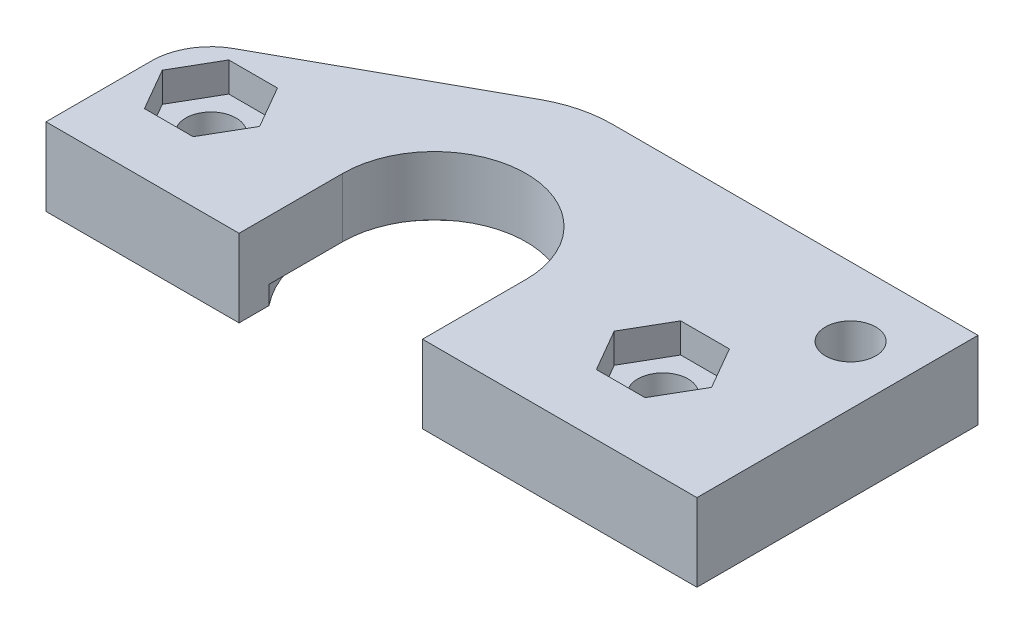
from build123d import *

# Parameters (mm, degrees)
ESBO_O1_R                = 1.7
RESSALTO_EXTRUS_O1_DEPTH = 5.25
ESBO_O2_R                = 7.95
CORTE_EXTRUS_O1_DEPTH    = 1.25
FILETE1_R                = 4
FILETE2_R                = 8
CORTE_EXTRUS_O2_DEPTH    = 2


with BuildPart() as part:
    # Esboço1 → Ressalto-extrusão1 (new body)
    with BuildSketch(Plane(origin=(0, 0, 0), x_dir=(1, 0, 0), z_dir=(0, 1, 0))):
        with BuildLine():
            Line((13.05, 0), (13.05, 7))
            ThreePointArc((13.05, 7), (19.25, 13.2), (25.45, 7))
            Line((25.45, 7), (25.45, 0))
            Line((25.45, 0), (44, 0))
            Line((44, 0), (44, 19))
            Line((44, 19), (17.2, 19))
            Line((17.2, 19), (0, 9.5))
            Line((0, 9.5), (0, 0))
            Line((0, 0), (13.05, 0))
        make_face()
        with Locations(Location((4.2, 6.95, 0), (0, 0, 90))):
            Circle(ESBO_O1_R, mode=Mode.SUBTRACT)
        with Locations(Location((34.75, 6.95, 0), (0, 0, 90))):
            Circle(ESBO_O1_R, mode=Mode.SUBTRACT)
        with Locations(Location((40.05, 14.337730871, 0), (0, 0, 90))):
            Circle(ESBO_O1_R, mode=Mode.SUBTRACT)
    extrude(amount=RESSALTO_EXTRUS_O1_DEPTH)

    # Esboço2 → Corte-extrusão1 (cut)
    with BuildSketch(Plane(origin=(0, 0, 0), x_dir=(1, 0, 0), z_dir=(0, 1, 0))):
        with Locations((19.25, 7)):
            Circle(ESBO_O2_R)
    extrude(amount=CORTE_EXTRUS_O1_DEPTH, mode=Mode.SUBTRACT)

    # Filete1
    filete1_edges = [part.edges().sort_by_distance(p)[0] for p in [
        (0, 2.625, -9.5),
    ]]
    fillet(filete1_edges, radius=FILETE1_R)

    # Filete2
    filete2_edges = [part.edges().sort_by_distance(p)[0] for p in [
        (17.2, 2.625, -19),
    ]]
    fillet(filete2_edges, radius=FILETE2_R)

    # Esboço3 → Corte-extrusão2 (cut)
    with BuildSketch(Plane(origin=(0, 5.25, 0), x_dir=(-1, 0, 0), z_dir=(0, -1, 0))):
        Polygon((-31.459103466, 6.95), (-33.104551733, 9.8), (-36.395448267, 9.8), (-38.040896534, 6.95), (-36.395448267, 4.1), (-33.104551733, 4.1), align=None)
        Polygon((-0.909103466, 6.95), (-2.554551733, 9.8), (-5.845448267, 9.8), (-7.490896534, 6.95), (-5.845448267, 4.1), (-2.554551733, 4.1), align=None)
    extrude(amount=CORTE_EXTRUS_O2_DEPTH, mode=Mode.SUBTRACT)


solid = part.part
